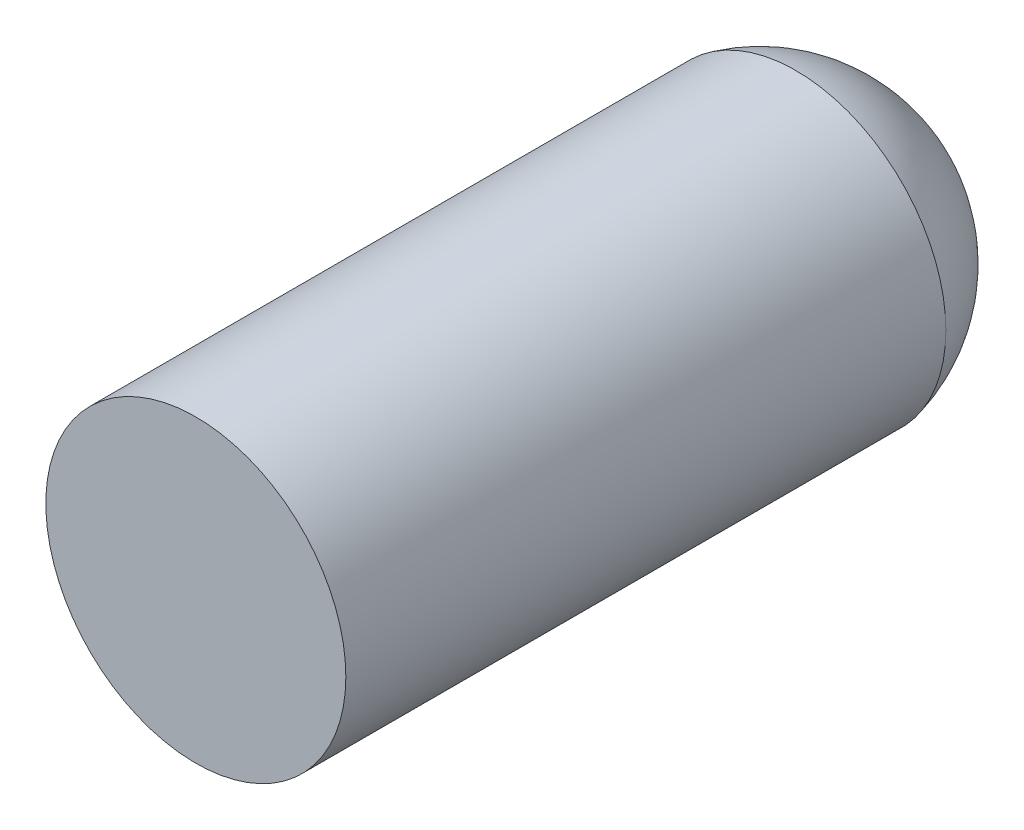
from build123d import *

# Parameters (mm, degrees)
SKETCH2_R           = 6.35
BOSS_EXTRUDE1_DEPTH = 25.4


with BuildPart() as part:
    # Sketch2 → Boss-Extrude1 (new body)
    with BuildSketch(Plane.XY):
        Circle(SKETCH2_R)
    extrude(amount=BOSS_EXTRUDE1_DEPTH)

    # Sketch7 → Revolve1 (revolve)
    with BuildSketch(Plane(origin=(0, 0, 0), x_dir=(1, 0, 0), z_dir=(0, 1, 0))):
        with BuildLine():
            Line((0, 0), (0, 5.012915966))
            ThreePointArc((0, 5.012915966), (4.045115155, 3.608657037), (6.35, 0))
            Line((6.35, 0), (0, 0))
        make_face()
    revolve(axis=Axis((0, 0, 0), (0, 0, -1)))


solid = part.part
